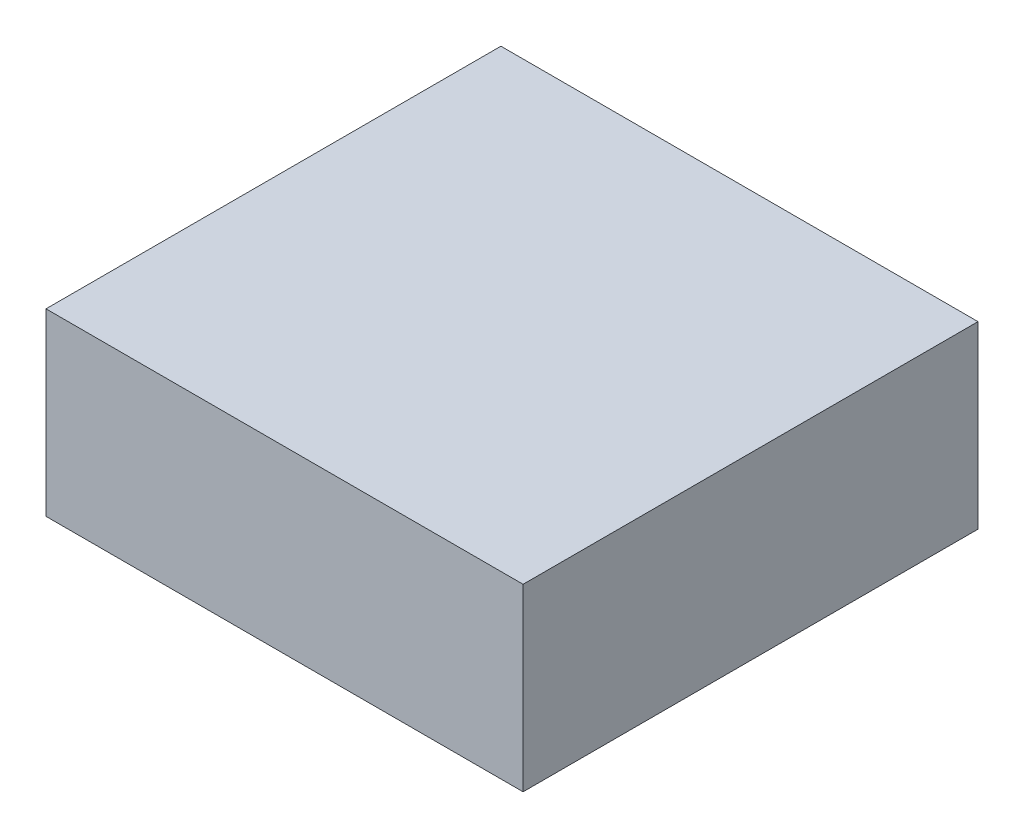
from build123d import *

# Parameters (mm, degrees)
CROQUIS1_W              = 430
CROQUIS1_H              = 410
SALIENTE_EXTRUIR1_DEPTH = 162


with BuildPart() as part:
    # Croquis1 → Saliente-Extruir1 (new body)
    with BuildSketch(Plane(origin=(0, 0, 0), x_dir=(1, 0, 0), z_dir=(0, 1, 0))):
        Rectangle(CROQUIS1_W, CROQUIS1_H)
    extrude(amount=SALIENTE_EXTRUIR1_DEPTH)


solid = part.part
